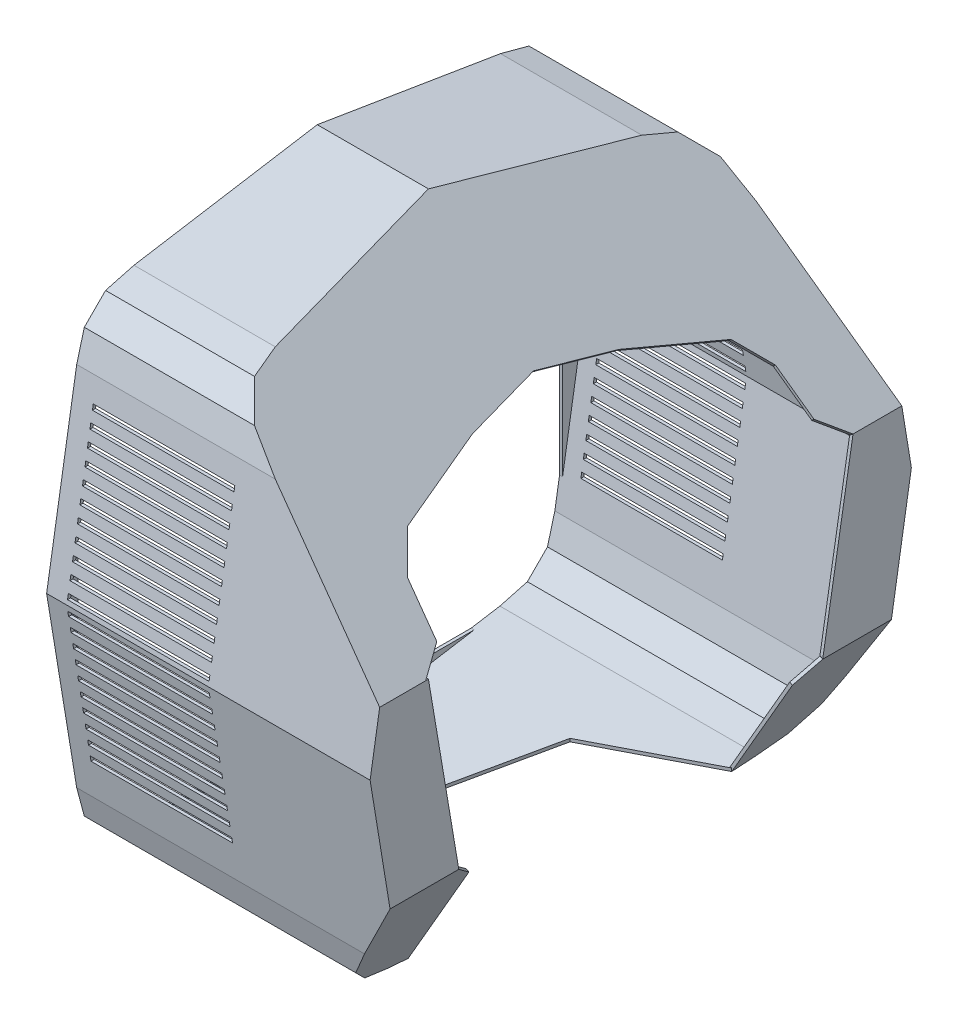
from build123d import *
from OCP.BRepFilletAPI import BRepFilletAPI_MakeChamfer

# Parameters (mm, degrees)
ESQUISSE1_R                  = 210
ESQUISSE1_R_2                = 6.75
BOSS_EXTRU_1_DEPTH           = 10
ESQUISSE2_R                  = 41.5
ESQUISSE2_R_2                = 6.75
BOSS_EXTRU_2_DEPTH           = 10
BOSS_EXTRU_3_DEPTH           = 10
CONG_1_R                     = 20
BOSS_EXTRU_4_DEPTH           = 320
BOSS_EXTRU_5_DEPTH           = 3
ESQUISSE6_W                  = 83.553938515
ESQUISSE6_H                  = 539.36045901
ENL_V_MAT_EXTRU_1_DEPTH      = 688.413362491
ENL_V_MAT_EXTRU_2_DEPTH      = 503.243387277
ENL_V_MAT_EXTRU_3_DEPTH      = 503.243387277
ENL_V_MAT_EXTRU_3_DEPTH_BACK = 503.243387277
ESQUISSE8_W                  = 140
ESQUISSE8_H                  = 5
ENL_V_MAT_EXTRU_4_DEPTH      = 503.243387277
ENL_V_MAT_EXTRU_4_DEPTH_BACK = 503.243387277
BOSS_EXTRU_6_DEPTH           = 3
ENL_V_MAT_EXTRU_5_DEPTH      = 3
BOSS_EXTRU_7_DEPTH           = 3
CHANFREIN1_SIZE              = 20
CHANFREIN1_SIZE2             = 22.778858086
BOSS_EXTRU_8_DEPTH           = 3


with BuildPart() as part:
    # Esquisse1 → Boss.-Extru.1 (new body)
    with BuildSketch(Plane(origin=(0, 0, 0), x_dir=(0, 0, -1), z_dir=(1, 0, 0))):
        Circle(ESQUISSE1_R)
        with Locations((-147.5, 0)):
            Circle(ESQUISSE1_R_2, mode=Mode.SUBTRACT)
        with Locations((-142.030299884, 39.795023746)):
            Circle(ESQUISSE1_R_2, mode=Mode.SUBTRACT)
        with Locations((-126.026862171, 76.63863263)):
            Circle(ESQUISSE1_R_2, mode=Mode.SUBTRACT)
        with Locations((-100.676588625, 107.798304731)):
            Circle(ESQUISSE1_R_2, mode=Mode.SUBTRACT)
        with Locations((-67.859593065, 130.963069714)):
            Circle(ESQUISSE1_R_2, mode=Mode.SUBTRACT)
        with Locations((49.394742795, 138.983486013)):
            Circle(ESQUISSE1_R_2, mode=Mode.SUBTRACT)
        with Locations((85.060347512, 120.503059219)):
            Circle(ESQUISSE1_R_2, mode=Mode.SUBTRACT)
        with Locations((114.417415379, 93.085471788)):
            Circle(ESQUISSE1_R_2, mode=Mode.SUBTRACT)
        with Locations((135.288666972, 58.764160752)):
            Circle(ESQUISSE1_R_2, mode=Mode.SUBTRACT)
        with Locations((146.12617704, 20.084580742)):
            Circle(ESQUISSE1_R_2, mode=Mode.SUBTRACT)
        with Locations((146.12617704, -20.084580742)):
            Circle(ESQUISSE1_R_2, mode=Mode.SUBTRACT)
        with Locations((135.288666972, -58.764160752)):
            Circle(ESQUISSE1_R_2, mode=Mode.SUBTRACT)
        with Locations((114.417415379, -93.085471788)):
            Circle(ESQUISSE1_R_2, mode=Mode.SUBTRACT)
        with Locations((85.060347512, -120.503059219)):
            Circle(ESQUISSE1_R_2, mode=Mode.SUBTRACT)
        with Locations((49.394742795, -138.983486013)):
            Circle(ESQUISSE1_R_2, mode=Mode.SUBTRACT)
        with Locations((-67.859593065, -130.963069714)):
            Circle(ESQUISSE1_R_2, mode=Mode.SUBTRACT)
        with Locations((-100.676588625, -107.798304731)):
            Circle(ESQUISSE1_R_2, mode=Mode.SUBTRACT)
        with Locations((-126.026862171, -76.63863263)):
            Circle(ESQUISSE1_R_2, mode=Mode.SUBTRACT)
        with Locations((-142.030299884, -39.795023746)):
            Circle(ESQUISSE1_R_2, mode=Mode.SUBTRACT)
        with BuildLine():
            Line((40, -130), (40, -126.318050967))
            ThreePointArc((40, -126.318050967), (132.5, 0), (40, 126.318050967))
            Line((40, 126.318050967), (40, 130))
            Line((40, 130), (40, 170))
            Line((40, 170), (-40, 170))
            Line((-40, 170), (-40, 130))
            Line((-40, 130), (-40, 126.318050967))
            ThreePointArc((-40, 126.318050967), (-132.5, 0), (-40, -126.318050967))
            Line((-40, -126.318050967), (-40, -130))
            Line((-40, -130), (-40, -170))
            Line((-40, -170), (40, -170))
            Line((40, -170), (40, -130))
        make_face(mode=Mode.SUBTRACT)
    extrude(amount=BOSS_EXTRU_1_DEPTH)

    # Esquisse2 → Boss.-Extru.2 (add)
    # profile 1 of 4: a face of its own
    with BuildSketch(Plane.ZY):
        with BuildLine():
            Line((-156.896697906, -269.680229505), (-80.976239027, -193.759770626))
            ThreePointArc((-80.976239027, -193.759770626), (-148.492424049, -148.492424049), (-193.759770626, -80.976239027))
            Line((-193.759770626, -80.976239027), (-269.680229505, -156.896697906))
            ThreePointArc((-269.680229505, -156.896697906), (-220.61731573, -220.61731573), (-156.896697906, -269.680229505))
        make_face()
        with Locations((-180.665782593, -180.665782593)):
            Circle(ESQUISSE2_R, mode=Mode.SUBTRACT)
        with Locations((-143.18912319, -218.142441996)):
            Circle(ESQUISSE2_R_2, mode=Mode.SUBTRACT)
        with Locations((-218.142441996, -143.18912319)):
            Circle(ESQUISSE2_R_2, mode=Mode.SUBTRACT)
    # profile 2 of 4: a face of its own
    with BuildSketch(Plane.ZY):
        with BuildLine():
            Line((80.976239027, -193.759770626), (156.896697906, -269.680229505))
            ThreePointArc((156.896697906, -269.680229505), (220.61731573, -220.61731573), (269.680229505, -156.896697906))
            Line((269.680229505, -156.896697906), (193.759770626, -80.976239027))
            ThreePointArc((193.759770626, -80.976239027), (148.492424049, -148.492424049), (80.976239027, -193.759770626))
        make_face()
        with Locations((143.18912319, -218.142441996)):
            Circle(ESQUISSE2_R_2, mode=Mode.SUBTRACT)
        with Locations((180.665782593, -180.665782593)):
            Circle(ESQUISSE2_R, mode=Mode.SUBTRACT)
        with Locations((218.142441996, -143.18912319)):
            Circle(ESQUISSE2_R_2, mode=Mode.SUBTRACT)
    # profile 3 of 4: a face of its own
    with BuildSketch(Plane.ZY):
        with BuildLine():
            Line((-269.680229505, 156.896697906), (-193.759770626, 80.976239027))
            ThreePointArc((-193.759770626, 80.976239027), (-148.492424049, 148.492424049), (-80.976239027, 193.759770626))
            Line((-80.976239027, 193.759770626), (-156.896697906, 269.680229505))
            ThreePointArc((-156.896697906, 269.680229505), (-220.61731573, 220.61731573), (-269.680229505, 156.896697906))
        make_face()
        with Locations((-218.142441996, 143.18912319)):
            Circle(ESQUISSE2_R_2, mode=Mode.SUBTRACT)
        with Locations((-180.665782593, 180.665782593)):
            Circle(ESQUISSE2_R, mode=Mode.SUBTRACT)
        with Locations((-143.18912319, 218.142441996)):
            Circle(ESQUISSE2_R_2, mode=Mode.SUBTRACT)
    # profile 4 of 4: a face of its own
    with BuildSketch(Plane.ZY):
        with BuildLine():
            ThreePointArc((269.680229505, 156.896697906), (220.61731573, 220.61731573), (156.896697906, 269.680229505))
            Line((156.896697906, 269.680229505), (80.976239027, 193.759770626))
            ThreePointArc((80.976239027, 193.759770626), (148.492424049, 148.492424049), (193.759770626, 80.976239027))
            Line((193.759770626, 80.976239027), (269.680229505, 156.896697906))
        make_face()
        with Locations((218.142441996, 143.18912319)):
            Circle(ESQUISSE2_R_2, mode=Mode.SUBTRACT)
        with Locations((143.18912319, 218.142441996)):
            Circle(ESQUISSE2_R_2, mode=Mode.SUBTRACT)
        with Locations((180.665782593, 180.665782593)):
            Circle(ESQUISSE2_R, mode=Mode.SUBTRACT)
    extrude(amount=-BOSS_EXTRU_2_DEPTH)

    # Esquisse3 → Boss.-Extru.3 (add)
    with BuildSketch(Plane(origin=(10, 0, 0), x_dir=(0, 0, -1), z_dir=(1, 0, 0))):
        Polygon((-156.896697906, -269.680229505), (156.896697906, -269.680229505), (126.896697906, -239.680229505), (-126.896697906, -239.680229505), align=None)
        Polygon((-269.680229505, -156.896697906), (-269.680229505, 156.896697906), (-239.680229505, 126.896697906), (-239.680229505, -126.896697906), align=None)
        Polygon((-156.896697906, 269.680229505), (156.896697906, 269.680229505), (126.896697906, 239.680229505), (-126.896697906, 239.680229505), align=None)
        Polygon((269.680229505, 156.896697906), (269.680229505, -156.896697906), (239.680229505, -126.896697906), (239.680229505, 126.896697906), align=None)
    extrude(amount=-BOSS_EXTRU_3_DEPTH)

    # Congé1
    cong_1_edges = [part.edges().sort_by_distance(p)[0] for p in [
        (5, -193.759770626, 80.976239027),
        (5, -80.976239027, 193.759770626),
        (5, 80.976239027, 193.759770626),
        (5, 193.759770626, 80.976239027),
        (5, 193.759770626, -80.976239027),
        (5, 80.976239027, -193.759770626),
        (5, -80.976239027, -193.759770626),
        (5, -193.759770626, -80.976239027),
        (5, -239.680229505, 126.896697906),
        (5, -239.680229505, -126.896697906),
        (5, -126.896697906, 239.680229505),
        (5, 126.896697906, 239.680229505),
        (5, 239.680229505, 126.896697906),
        (5, 239.680229505, -126.896697906),
        (5, 126.896697906, -239.680229505),
        (5, -126.896697906, -239.680229505),
    ]]
    fillet(cong_1_edges, radius=CONG_1_R)

    # Esquisse4 → Boss.-Extru.4 (add)
    with BuildSketch(Plane(origin=(10, 0, 0), x_dir=(0, 0, -1), z_dir=(1, 0, 0))):
        Polygon((-237.95405173, -181.298584932), (-267.720395248, 0), (-237.95405173, 181.298584932), (-230.425721298, 209.3946966), (-209.3946966, 230.425721298), (-181.298584932, 237.95405173), (0, 267.720395248), (181.298584932, 237.95405173), (209.3946966, 230.425721298), (230.425721298, 209.3946966), (237.95405173, 181.298584932), (267.720395248, 0), (237.95405173, -181.298584932), (230.425721298, -209.3946966), (209.3946966, -230.425721298), (181.298584932, -237.95405173), (0, -267.720395248), (-181.298584932, -237.95405173), (-209.3946966, -230.425721298), (-230.425721298, -209.3946966), align=None)
        Polygon((227.735994882, 207.841782329), (207.841782329, 227.735994882), (180.665782593, 235.017782065), (0, 264.680229505), (-180.665782593, 235.017782065), (-207.841782329, 227.735994882), (-227.735994882, 207.841782329), (-235.017782065, 180.665782593), (-264.680229505, 0), (-235.017782065, -180.665782593), (-227.735994882, -207.841782329), (-207.841782329, -227.735994882), (-180.665782593, -235.017782065), (0, -264.680229505), (180.665782593, -235.017782065), (207.841782329, -227.735994882), (227.735994882, -207.841782329), (235.017782065, -180.665782593), (264.680229505, 0), (235.017782065, 180.665782593), align=None, mode=Mode.SUBTRACT)
    extrude(amount=BOSS_EXTRU_4_DEPTH)

    # Esquisse5 → Boss.-Extru.5 (add)
    with BuildSketch(Plane(origin=(10, 0, 0), x_dir=(0, 0, -1), z_dir=(1, 0, 0))):
        Polygon((-239.680229505, 78.612426659), (-239.680229505, -78.612426659), (-239.680229505, -152.268101742), (-264.680229505, 0), (-239.680229505, 152.268101742), align=None)
        Polygon((78.612426659, 239.680229505), (-78.612426659, 239.680229505), (-152.268101742, 239.680229505), (0, 264.680229505), (152.268101742, 239.680229505), align=None)
        Polygon((239.680229505, -78.612426659), (239.680229505, 78.612426659), (239.680229505, 152.268101742), (264.680229505, 0), (239.680229505, -152.268101742), align=None)
        Polygon((-78.612426659, -239.680229505), (78.612426659, -239.680229505), (152.268101742, -239.680229505), (0, -264.680229505), (-152.268101742, -239.680229505), align=None)
    extrude(amount=BOSS_EXTRU_5_DEPTH)

    # Esquisse6 → Enlèv. mat.-Extru.1 (cut, through all)
    with BuildSketch(Plane(origin=(0, 269.680229505, 0), x_dir=(1, 0, 0), z_dir=(0, 1, 0))):
        with Locations((-31.776969257, 0)):
            Rectangle(ESQUISSE6_W, ESQUISSE6_H)
    extrude(amount=-ENL_V_MAT_EXTRU_1_DEPTH, mode=Mode.SUBTRACT)

    # Esquisse7 → Enlèv. mat.-Extru.2 (cut, through all)
    with BuildSketch(Plane(origin=(0, 0, 0), x_dir=(1, 0, 0), z_dir=(0, 1, 0))):
        Polygon((260, 160), (146.86291501, 113.13708499), (100, 0), (146.86291501, -113.13708499), (260, -160), (420, -160), (420, 0), (420, 160), align=None)
    extrude(amount=-ENL_V_MAT_EXTRU_2_DEPTH, mode=Mode.SUBTRACT)

    # Esquisse8 → Enlèv. mat.-Extru.3 (cut, two sides: drawn at the far end of the back side and taken through both)
    with BuildSketch(Plane.XY.offset(-ENL_V_MAT_EXTRU_3_DEPTH_BACK)):
        with Locations((100, 156.798584932)):
            Rectangle(ESQUISSE8_W, ESQUISSE8_H)
        with Locations((100, 141.798584932)):
            Rectangle(ESQUISSE8_W, ESQUISSE8_H)
        with Locations((100, 126.798584932)):
            Rectangle(ESQUISSE8_W, ESQUISSE8_H)
        with Locations((100, 111.798584932)):
            Rectangle(ESQUISSE8_W, ESQUISSE8_H)
        with Locations((100, 96.798584932)):
            Rectangle(ESQUISSE8_W, ESQUISSE8_H)
        with Locations((100, 81.798584932)):
            Rectangle(ESQUISSE8_W, ESQUISSE8_H)
        with Locations((100, 66.798584932)):
            Rectangle(ESQUISSE8_W, ESQUISSE8_H)
        with Locations((100, 51.798584932)):
            Rectangle(ESQUISSE8_W, ESQUISSE8_H)
        with Locations((100, 36.798584932)):
            Rectangle(ESQUISSE8_W, ESQUISSE8_H)
        with Locations((100, 21.798584932)):
            Rectangle(ESQUISSE8_W, ESQUISSE8_H)
        with Locations((100, 6.798584932)):
            Rectangle(ESQUISSE8_W, ESQUISSE8_H)
        with Locations((100, -8.201415068)):
            Rectangle(ESQUISSE8_W, ESQUISSE8_H)
        with Locations((100, -23.201415068)):
            Rectangle(ESQUISSE8_W, ESQUISSE8_H)
        with Locations((100, -38.201415068)):
            Rectangle(ESQUISSE8_W, ESQUISSE8_H)
        with Locations((100, -53.201415068)):
            Rectangle(ESQUISSE8_W, ESQUISSE8_H)
        with Locations((100, -68.201415068)):
            Rectangle(ESQUISSE8_W, ESQUISSE8_H)
        with Locations((100, -83.201415068)):
            Rectangle(ESQUISSE8_W, ESQUISSE8_H)
        with Locations((100, -98.201415068)):
            Rectangle(ESQUISSE8_W, ESQUISSE8_H)
        with Locations((100, -113.201415068)):
            Rectangle(ESQUISSE8_W, ESQUISSE8_H)
        with Locations((100, -128.201415068)):
            Rectangle(ESQUISSE8_W, ESQUISSE8_H)
        with Locations((100, -143.201415068)):
            Rectangle(ESQUISSE8_W, ESQUISSE8_H)
    extrude(amount=ENL_V_MAT_EXTRU_3_DEPTH + ENL_V_MAT_EXTRU_3_DEPTH_BACK, mode=Mode.SUBTRACT)

    # Esquisse9 → Enlèv. mat.-Extru.4 (cut, two sides: drawn at the far end of the back side and taken through both)
    with BuildSketch(Plane.XY.offset(-ENL_V_MAT_EXTRU_4_DEPTH_BACK)):
        Polygon((330, 57.720395248), (120, 267.720395248), (330, 267.720395248), align=None)
        Polygon((330, -120.207384025), (260, -241.450940555), (330, -241.450940555), align=None)
    extrude(amount=ENL_V_MAT_EXTRU_4_DEPTH + ENL_V_MAT_EXTRU_4_DEPTH_BACK, mode=Mode.SUBTRACT)

    # Esquisse10 → Boss.-Extru.6 (add)
    with BuildSketch(Plane(origin=(193.860197624, 193.860197624, 0), x_dir=(0, 0, -1), z_dir=(0.7071067811865513, 0.7071067811865438, 0))):
        Polygon((258.243624574, -192.530754899), (-258.243624574, -192.530754899), (-230.425721298, 21.969099136), (-209.3946966, 51.711459495), (-181.298584932, 62.358126494), (0, 104.4540932), (181.298584932, 62.358126494), (209.3946966, 51.711459495), (230.425721298, 21.969099136), (237.95405173, -17.764803034), align=None)
    extrude(amount=-BOSS_EXTRU_6_DEPTH)

    # Esquisse11 → Enlèv. mat.-Extru.5 (cut)
    with BuildSketch(Plane(origin=(193.860197624, 193.860197624, 0), x_dir=(0, 0, -1), z_dir=(0.7071067811865513, 0.7071067811865438, 0))):
        Polygon((0, -42.530754899), (72.437955406, -59.350222961), (160, -92.530754899), (182.002969016, -123.647652093), (190, -192.530754899), (-190, -192.530754899), (-182.002969016, -123.647652093), (-160, -92.530754899), (-72.437955406, -59.350222961), align=None)
    extrude(amount=-ENL_V_MAT_EXTRU_5_DEPTH, mode=Mode.SUBTRACT)

    # Esquisse12 → Boss.-Extru.7 (add)
    with BuildSketch(Plane(origin=(299.551324144, -172.946037631, 0), x_dir=(0, 0, -1), z_dir=(0.8660254037844419, -0.49999999999999456, 0))):
        Polygon((160, -79.102648288), (160, -75.592167268), (160, 60.897351712), (244.944089327, 60.897351712), (247.98425507, 60.897351712), (237.95405173, -9.644690866), (230.425721298, -42.087286135), (209.3946966, -66.371821677), (181.298584932, -75.06478888), align=None)
        Polygon((-181.298584932, -75.06478888), (-160, -79.102648288), (-160, -75.592167268), (-160, 60.897351712), (-244.944089327, 60.897351712), (-247.98425507, 60.897351712), (-237.95405173, -9.644690866), (-230.425721298, -42.087286135), (-209.3946966, -66.371821677), align=None)
    extrude(amount=-BOSS_EXTRU_7_DEPTH)

    # Chanfrein1: one chamfer whose edges measure the first distance from different faces: ONE call of the kernel's chamfer builder (chamfer() names one face for all edges)
    chanfrein1_edges_1 = [part.edges().sort_by_distance(p)[0] for p in [
        (328.939339828, 56.659735077, -190),
    ]]
    chanfrein1_side_1 = [part.faces().sort_by_distance(p)[0] for p in [
        (328.938398083, 56.658793331, -222.688878489),
    ]]
    chanfrein1_edges_2 = [part.edges().sort_by_distance(p)[0] for p in [
        (328.939339828, 56.659735077, 190),
    ]]
    chanfrein1_side_2 = [part.faces().sort_by_distance(p)[0] for p in [
        (304.585485277, 81.013589628, 186.001484508),
    ]]
    chanfrein1_edges_3 = [part.edges().sort_by_distance(p)[0] for p in [
        (328.700961894, -119.457384025, -160),
        (328.700961894, -119.457384025, 160),
    ]]
    chanfrein1 = BRepFilletAPI_MakeChamfer(part.part.solid().wrapped)
    for e in chanfrein1_edges_1:
        chanfrein1.Add(CHANFREIN1_SIZE, CHANFREIN1_SIZE2, e.wrapped, chanfrein1_side_1[0].wrapped)  # the first distance lies on this face
    for e in chanfrein1_edges_2:
        chanfrein1.Add(CHANFREIN1_SIZE, CHANFREIN1_SIZE2, e.wrapped, chanfrein1_side_2[0].wrapped)  # the first distance lies on this face
    for e in chanfrein1_edges_3:
        chanfrein1.Add(CHANFREIN1_SIZE, e.wrapped)
    add(Compound.cast(chanfrein1.Shape()), mode=Mode.REPLACE)

    # Esquisse13 → Boss.-Extru.8 (add)
    with BuildSketch(Plane(origin=(330, 0, 0), x_dir=(0, 0, -1), z_dir=(1, 0, 0))):
        Polygon((258.243624574, 57.720395248), (267.720395248, 0), (247.98425507, -120.207384025), (180, -120.207384025), (210, 57.720395248), align=None)
        Polygon((-210, 57.720395248), (-258.243624574, 57.720395248), (-267.720395248, 0), (-247.98425507, -120.207384025), (-180, -120.207384025), align=None)
    extrude(amount=-BOSS_EXTRU_8_DEPTH)


solid = part.part
